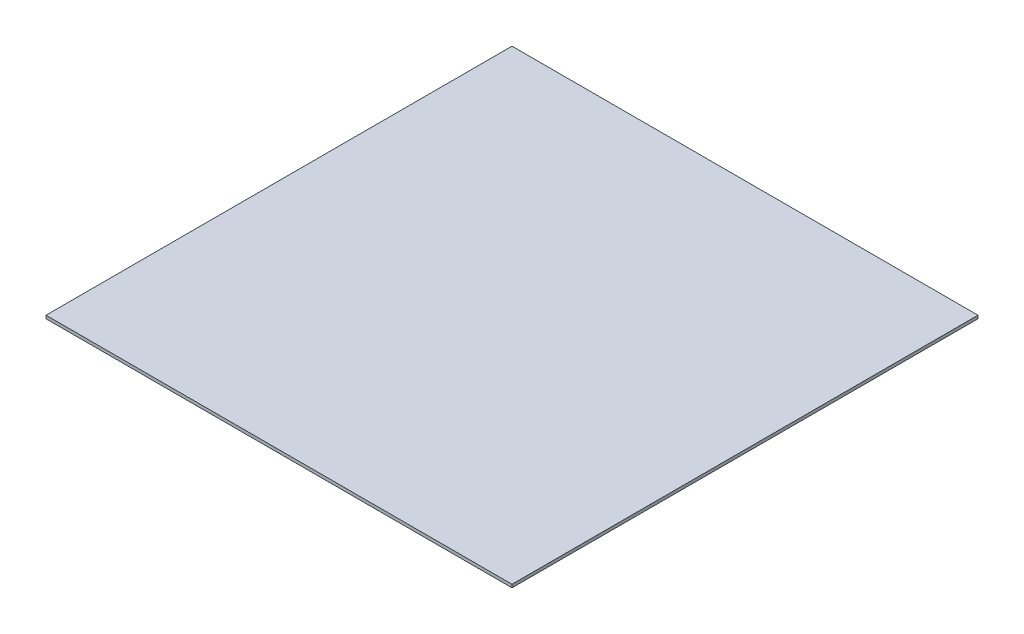
from build123d import *

# Parameters (mm, degrees)
SKETCH1_W           = 15
SKETCH1_H           = 15
BOSS_EXTRUDE1_DEPTH = 0.1


with BuildPart() as part:
    # Sketch1 → Boss-Extrude1 (new body)
    with BuildSketch(Plane(origin=(0, 0, 0), x_dir=(1, 0, 0), z_dir=(0, 1, 0))):
        Rectangle(SKETCH1_W, SKETCH1_H)
    extrude(amount=BOSS_EXTRUDE1_DEPTH)


solid = part.part
